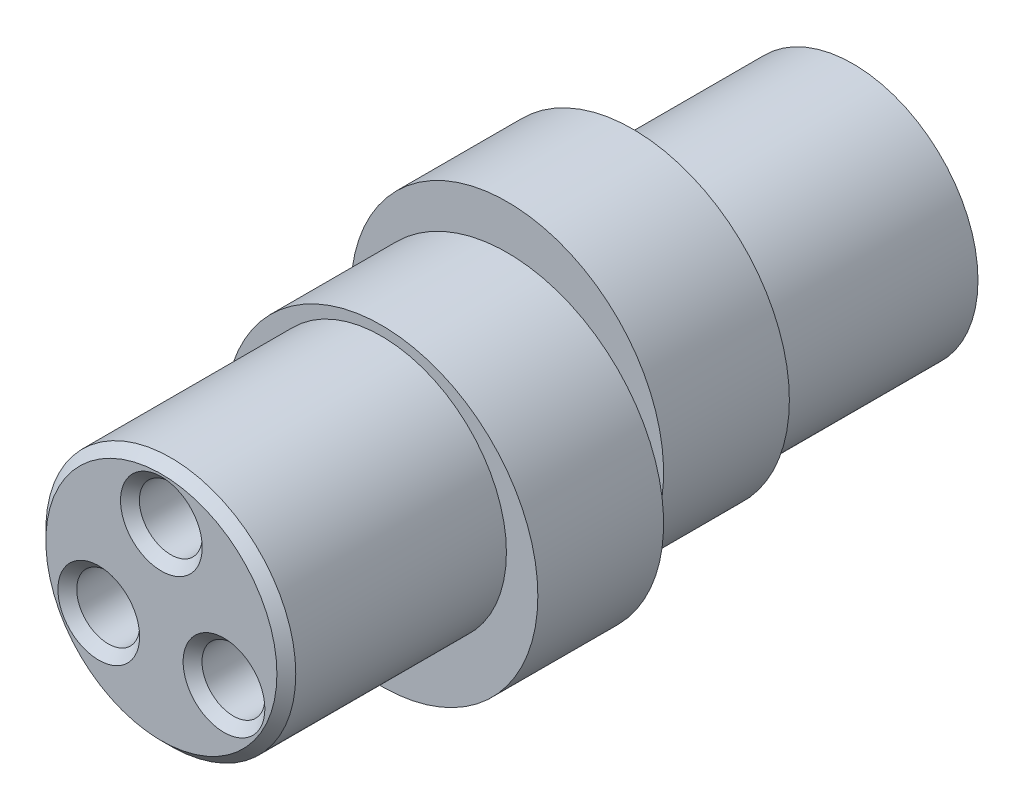
from build123d import *

# Parameters (mm, degrees)
SKETCH1_R                = 4.975
BOSS_EXTRUDE1_DEPTH      = 4
BOSS_EXTRUDE2_START      = 4
SKETCH2_R                = 4.975
BOSS_EXTRUDE2_DEPTH      = 4
BOSS_EXTRUDE5_DEPTH      = 15
BOSS_EXTRUDE5_DEPTH_BACK = 7
SKETCH5_R                = 3.975
CUT_EXTRUDE1_DEPTH       = 17.791552936
CUT_EXTRUDE1_DEPTH_BACK  = 17.791552936
SKETCH9_R                = 1
CHAMFER1_SIZE            = 0.3


with BuildPart() as part:
    # Sketch1 → Boss-Extrude1 (new body)
    with BuildSketch(Plane.XY):
        with Locations((0, 0.7)):
            Circle(SKETCH1_R)
    extrude(amount=BOSS_EXTRUDE1_DEPTH)

    # Sketch2 → Boss-Extrude2 (add)
    with BuildSketch(Plane.XY.offset(BOSS_EXTRUDE2_START)):
        with Locations(Location((0, -0.7, 0), (0, 0, 171.911442188))):
            Circle(SKETCH2_R)
    extrude(amount=BOSS_EXTRUDE2_DEPTH)

    # Sketch5 → Boss-Extrude5 (add, two sides: drawn at the far end of the back side and taken through both)
    with BuildSketch(Plane.XY.offset(-BOSS_EXTRUDE5_DEPTH_BACK)):
        Circle(SKETCH5_R)
    extrude(amount=BOSS_EXTRUDE5_DEPTH + BOSS_EXTRUDE5_DEPTH_BACK)

    # Sketch9 → Cut-Extrude1 (cut, two sides: drawn at the far end of the back side and taken through both)
    with BuildSketch(Plane.XY.offset(-CUT_EXTRUDE1_DEPTH_BACK)):
        with BuildLine():
            ThreePointArc((0, 3.3), (-1, 2.3), (0, 1.3))
            Line((0, 1.3), (0, 3.3))
        make_face()
        with BuildLine():
            Line((0, 3.3), (0, 1.3))
            ThreePointArc((0, 1.3), (0.707106781, 1.592893219), (1, 2.3))
            ThreePointArc((1, 2.3), (0.707106781, 3.007106781), (0, 3.3))
        make_face()
        with Locations((-1.991858429, -1.15)):
            Circle(SKETCH9_R)
        with Locations((1.991858429, -1.15)):
            Circle(SKETCH9_R)
    extrude(amount=CUT_EXTRUDE1_DEPTH + CUT_EXTRUDE1_DEPTH_BACK, mode=Mode.SUBTRACT)

    # Chamfer1
    chamfer1_edges = [part.edges().sort_by_distance(p)[0] for p in [
        (-3.975, 0, 15),
        (0, 1.3, 15),
        (-2.991858429, -1.15, 15),
        (0.991858429, -1.15, 15),
    ]]
    chamfer(chamfer1_edges, length=CHAMFER1_SIZE)


solid = part.part
